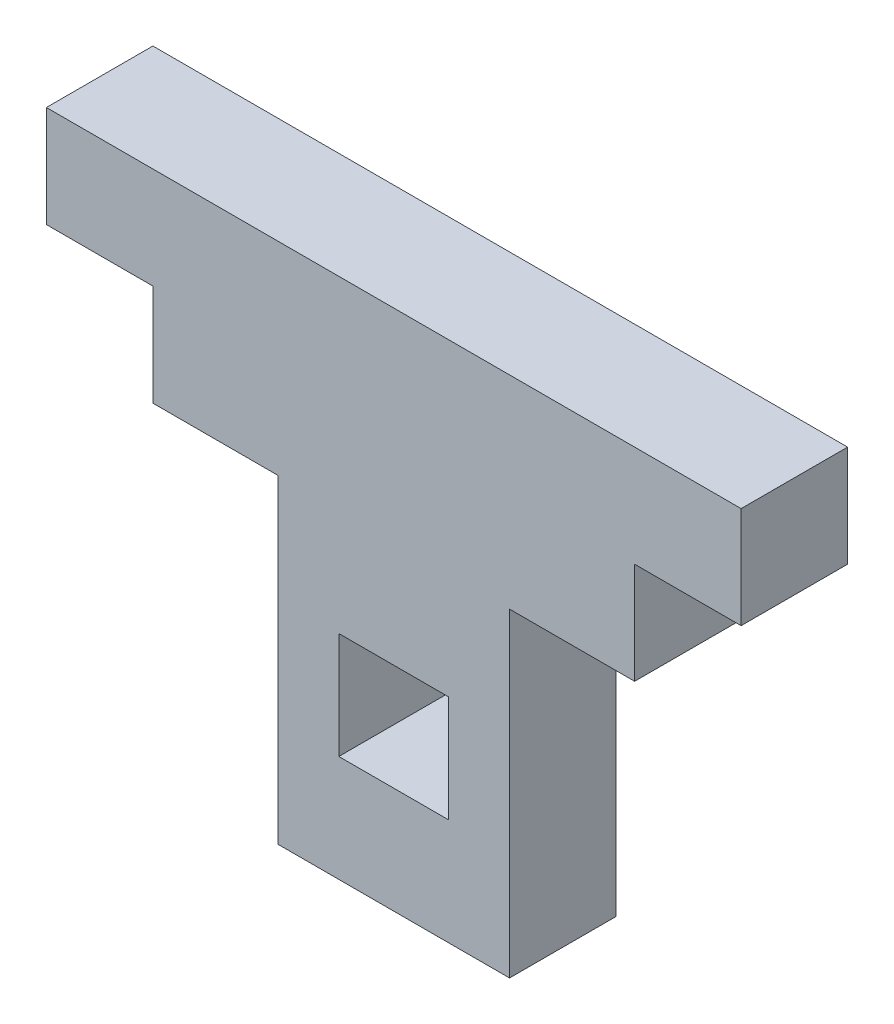
from build123d import *

# Parameters (mm, degrees)
SKETCH1_W            = 24.13
SKETCH1_H            = 10.16
BOSS_EXTRUDE1_DEPTH  = 5.334
SKETCH6_W            = 5.334
SKETCH6_H            = 10.16
BOSS_EXTRUDE5_DEPTH  = 5.334
SKETCH11_W           = 5.334
SKETCH11_H           = 10.206206115
BOSS_EXTRUDE6_DEPTH  = 5.334
SKETCH12_W           = 34.798
SKETCH12_H           = 5.334
BOSS_EXTRUDE7_DEPTH  = 5.334
SKETCH13_W           = 5.334
SKETCH13_H           = 0.046206115
CUT_EXTRUDE1_DEPTH   = 32.634561721
SKETCH17_W           = 11.599333333
SKETCH17_H           = 5.334
CUT_EXTRUDE5_DEPTH   = 5.334
SKETCH18_W           = 5.334
SKETCH18_H           = 5.08
SKETCH18_W_2         = 11.684
CUT_EXTRUDE6_DEPTH   = 5.334
SKETCH19_W           = 5.334
SKETCH19_H           = 5.08
BOSS_EXTRUDE8_DEPTH  = 5.334
SKETCH20_W           = 5.334
SKETCH20_H           = 5.08
BOSS_EXTRUDE10_DEPTH = 1.016
SKETCH21_W           = 11.599333334
SKETCH21_H           = 5.334
BOSS_EXTRUDE11_DEPTH = 10.668
SKETCH22_W           = 5.503333334
SKETCH22_H           = 5.334
CUT_EXTRUDE7_DEPTH   = 34.950594339
SKETCH23_W           = 5.334
SKETCH23_H           = 5.08
BOSS_EXTRUDE12_DEPTH = 5.334
SKETCH24_W           = 5.334
SKETCH24_H           = 5.08
CUT_EXTRUDE8_DEPTH   = 5.334
SKETCH25_W           = 5.334
SKETCH25_H           = 5.08
BOSS_EXTRUDE13_DEPTH = 5.334
SKETCH26_W           = 5.334
SKETCH26_H           = 5.08
CUT_EXTRUDE9_DEPTH   = 5.334


with BuildPart() as part:
    # Sketch1 → Boss-Extrude1 (new body)
    with BuildSketch(Plane.XY):
        with Locations((12.065, 5.08)):
            Rectangle(SKETCH1_W, SKETCH1_H)
    extrude(amount=BOSS_EXTRUDE1_DEPTH)

    # Sketch6 → Boss-Extrude5 (add)
    with BuildSketch(Plane(origin=(24.13, 0, 0), x_dir=(0, 0, -1), z_dir=(1, 0, 0))):
        with Locations((-2.667, 5.08)):
            Rectangle(SKETCH6_W, SKETCH6_H)
    extrude(amount=BOSS_EXTRUDE5_DEPTH)

    # Sketch11 → Boss-Extrude6 (add)
    with BuildSketch(Plane.ZY):
        with Locations((2.667, 5.103103058)):
            Rectangle(SKETCH11_W, SKETCH11_H)
    extrude(amount=BOSS_EXTRUDE6_DEPTH)

    # Sketch12 → Boss-Extrude7 (add)
    with BuildSketch(Plane(origin=(0, 0, 0), x_dir=(-1, 0, 0), z_dir=(0, -1, 0))):
        with Locations((-12.065, -2.667)):
            Rectangle(SKETCH12_W, SKETCH12_H)
    extrude(amount=BOSS_EXTRUDE7_DEPTH)

    # Sketch13 → Cut-Extrude1 (cut, through all)
    with BuildSketch(Plane(origin=(0, 0, 0), x_dir=(-1, 0, 0), z_dir=(0, 0, -1))):
        with Locations((2.667, 10.183103058)):
            Rectangle(SKETCH13_W, SKETCH13_H)
    extrude(amount=-CUT_EXTRUDE1_DEPTH, mode=Mode.SUBTRACT)

    # Sketch17 → Cut-Extrude5 (cut)
    with BuildSketch(Plane(origin=(0, -5.334, 0), x_dir=(-1, 0, 0), z_dir=(0, -1, 0))):
        with Locations((-0.465666666, -2.667)):
            Rectangle(SKETCH17_W, SKETCH17_H)
        with Locations((-23.664333334, -2.667)):
            Rectangle(SKETCH17_W, SKETCH17_H)
    extrude(amount=-CUT_EXTRUDE5_DEPTH, mode=Mode.SUBTRACT)

    # Sketch18 → Cut-Extrude6 (cut)
    with BuildSketch(Plane.XY.offset(5.334)):
        with Locations((-2.667, 7.62)):
            Rectangle(SKETCH18_W, SKETCH18_H)
        with Locations((23.622, 7.62)):
            Rectangle(SKETCH18_W_2, SKETCH18_H)
    extrude(amount=-CUT_EXTRUDE6_DEPTH, mode=Mode.SUBTRACT)

    # Sketch19 → Boss-Extrude8 (add)
    with BuildSketch(Plane(origin=(17.78, 0, 0), x_dir=(0, 0, -1), z_dir=(1, 0, 0))):
        with Locations((-2.667, 7.62)):
            Rectangle(SKETCH19_W, SKETCH19_H)
    extrude(amount=BOSS_EXTRUDE8_DEPTH)

    # Sketch20 → Boss-Extrude10 (add)
    with BuildSketch(Plane(origin=(23.114, 0, 0), x_dir=(0, 0, -1), z_dir=(1, 0, 0))):
        with Locations((-2.667, 7.62)):
            Rectangle(SKETCH20_W, SKETCH20_H)
    extrude(amount=BOSS_EXTRUDE10_DEPTH)

    # Sketch21 → Boss-Extrude11 (add)
    with BuildSketch(Plane.XZ.offset(5.334)):
        with Locations((12.065, 2.667)):
            Rectangle(SKETCH21_W, SKETCH21_H)
    extrude(amount=BOSS_EXTRUDE11_DEPTH)

    # Sketch22 → Cut-Extrude7 (cut, through all)
    with BuildSketch(Plane.XY.offset(5.334)):
        with Locations((12.065, -8.001)):
            Rectangle(SKETCH22_W, SKETCH22_H)
    extrude(amount=-CUT_EXTRUDE7_DEPTH, mode=Mode.SUBTRACT)

    # Sketch23 → Boss-Extrude12 (add)
    with BuildSketch(Plane.ZY):
        with Locations((2.667, 7.62)):
            Rectangle(SKETCH23_W, SKETCH23_H)
    extrude(amount=BOSS_EXTRUDE12_DEPTH)

    # Sketch24 → Cut-Extrude8 (cut)
    with BuildSketch(Plane.ZY.offset(5.334)):
        with Locations((2.667, 2.54)):
            Rectangle(SKETCH24_W, SKETCH24_H)
    extrude(amount=-CUT_EXTRUDE8_DEPTH, mode=Mode.SUBTRACT)

    # Sketch25 → Boss-Extrude13 (add)
    with BuildSketch(Plane(origin=(24.13, 0, 0), x_dir=(0, 0, -1), z_dir=(1, 0, 0))):
        with Locations((-2.667, 7.62)):
            Rectangle(SKETCH25_W, SKETCH25_H)
    extrude(amount=BOSS_EXTRUDE13_DEPTH)

    # Sketch26 → Cut-Extrude9 (cut)
    with BuildSketch(Plane(origin=(29.464, 0, 0), x_dir=(0, 0, -1), z_dir=(1, 0, 0))):
        with Locations((-2.667, 2.54)):
            Rectangle(SKETCH26_W, SKETCH26_H)
    extrude(amount=-CUT_EXTRUDE9_DEPTH, mode=Mode.SUBTRACT)


solid = part.part
